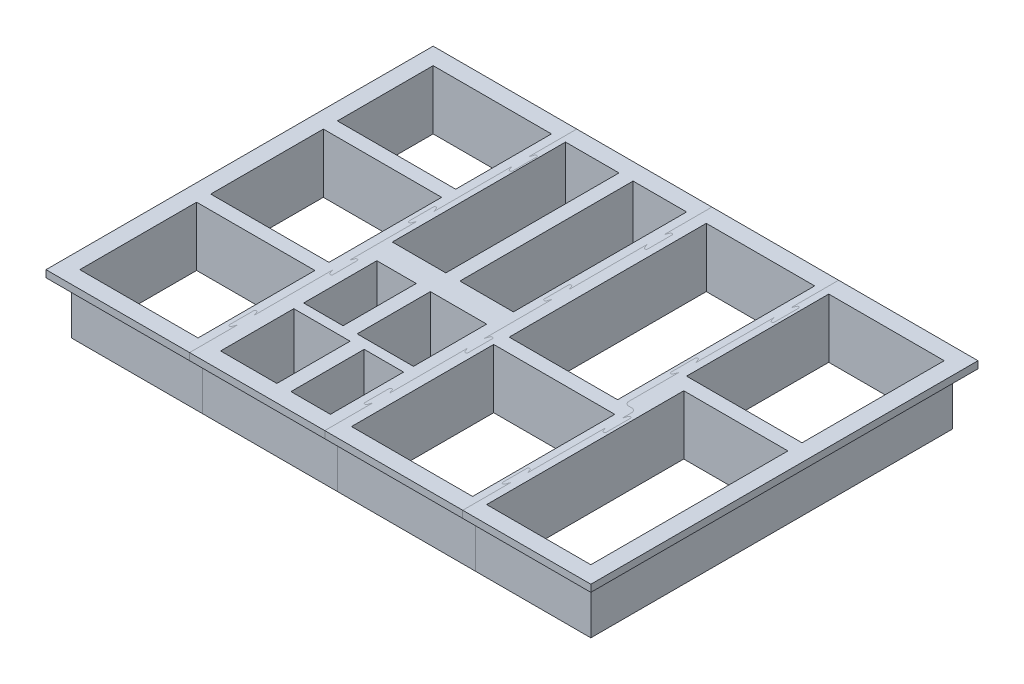
from build123d import *

# Parameters (mm, degrees)
SKETCH1_W                = 387
SKETCH1_H                = 275
BOSS_EXTRUDE1_DEPTH      = 47
SKETCH3_OUTSIDE_W        = 484.416
SKETCH3_OUTSIDE_H        = 372.416
SKETCH3_OUTSIDE_W_2      = 369
SKETCH3_OUTSIDE_H_2      = 257
CUT_EXTRUDE2_DEPTH       = 42
SKETCH2_W                = 84
SKETCH2_H                = 83
SKETCH2_H_2              = 80
SKETCH2_H_3              = 68
SKETCH2_W_2              = 74
SKETCH2_H_4              = 140
SKETCH2_W_3              = 82
SKETCH2_H_5              = 101
SKETCH2_W_4              = 77
SKETCH2_W_5              = 38
SKETCH2_H_6              = 123
SKETCH2_W_6              = 28
SKETCH2_H_7              = 52
SKETCH2_W_7              = 40
SKETCH2_W_8              = 86
CUT_EXTRUDE3_DEPTH       = 43
SKETCH4_W                = 92
SKETCH4_H                = 13.5
CUT_EXTRUDE4_DEPTH       = 35
SPLIT1_SURFACE_1_1_BACK  = 478.078
SPLIT1_SURFACE_1_1_DEPTH = 956.156
SPLIT1_SURFACE_1_2_BACK  = 478.078
SPLIT1_SURFACE_1_2_DEPTH = 956.156
SPLIT1_SURFACE_2_3_BACK  = 478.078
SPLIT1_SURFACE_2_3_DEPTH = 956.156
SPLIT1_SURFACE_2_4_BACK  = 478.078
SPLIT1_SURFACE_2_4_DEPTH = 956.156
SPLIT1_SURFACE_3_5_BACK  = 478.078
SPLIT1_SURFACE_3_5_DEPTH = 956.156
SPLIT1_SURFACE_3_6_BACK  = 478.078
SPLIT1_SURFACE_3_6_DEPTH = 956.156
SKETCH8_W                = 257
SKETCH8_H                = 5
CUT_EXTRUDE5_DEPTH       = 405.968208629


with BuildPart() as part:
    # Sketch1 → Boss-Extrude1 (new body)
    with BuildSketch(Plane(origin=(0, 0, 0), x_dir=(1, 0, 0), z_dir=(0, 1, 0))):
        Rectangle(SKETCH1_W, SKETCH1_H)
    extrude(amount=BOSS_EXTRUDE1_DEPTH)

    # Sketch3 outside → Cut-Extrude2 (cut)
    with BuildSketch(Plane(origin=(0, 0, 0), x_dir=(-1, 0, 0), z_dir=(0, -1, 0))):
        Rectangle(SKETCH3_OUTSIDE_W, SKETCH3_OUTSIDE_H)
        Rectangle(SKETCH3_OUTSIDE_W_2, SKETCH3_OUTSIDE_H_2, mode=Mode.SUBTRACT)
    extrude(amount=-CUT_EXTRUDE2_DEPTH, mode=Mode.SUBTRACT)

    # Sketch2 → Cut-Extrude3 (cut)
    with BuildSketch(Plane(origin=(0, 47, 0), x_dir=(1, 0, 0), z_dir=(0, 1, 0))):
        with Locations((-139.5, -84)):
            Rectangle(SKETCH2_W, SKETCH2_H)
        with Locations((-139.5, 7.5)):
            Rectangle(SKETCH2_W, SKETCH2_H_2)
        with Locations((-139.5, 91.5)):
            Rectangle(SKETCH2_W, SKETCH2_H_3)
        with Locations((144.5, -55.5)):
            Rectangle(SKETCH2_W_2, SKETCH2_H_4)
        with Locations((140.5, 75)):
            Rectangle(SKETCH2_W_3, SKETCH2_H_5)
        with Locations((51, 55.5)):
            Rectangle(SKETCH2_W_4, SKETCH2_H_4)
        with Locations((-20.5, 64)):
            Rectangle(SKETCH2_W_5, SKETCH2_H_6)
        with Locations((-68.5, 64)):
            Rectangle(SKETCH2_W_5, SKETCH2_H_6)
        with Locations((-67.5, -40.5)):
            Rectangle(SKETCH2_W_6, SKETCH2_H_7)
        with Locations((-61.5, -99.5)):
            Rectangle(SKETCH2_W_7, SKETCH2_H_7)
        with Locations((-23.5, -40.5)):
            Rectangle(SKETCH2_W_7, SKETCH2_H_7)
        with Locations((-17.5, -99.5)):
            Rectangle(SKETCH2_W_6, SKETCH2_H_7)
        with Locations((54.5, -75)):
            Rectangle(SKETCH2_W_8, SKETCH2_H_5)
    extrude(amount=-CUT_EXTRUDE3_DEPTH, mode=Mode.SUBTRACT)

    # Sketch4 → Cut-Extrude4 (cut)
    with BuildSketch(Plane.XZ):
        with Locations((-42.5, 6.75)):
            Rectangle(SKETCH4_W, SKETCH4_H)
    extrude(amount=-CUT_EXTRUDE4_DEPTH, mode=Mode.SUBTRACT)


with BuildPart() as body_2:
    # Split1: the piece behind the surface
    add(part.part)
    # Split1 surface 1: a surface, the sketch's curves swept straight by 956.156 mm
    with BuildLine(Plane(origin=(0, 47, 0), x_dir=(1, 0, 0), z_dir=(0, 1, 0)).offset(-SPLIT1_SURFACE_1_1_BACK), mode=Mode.PRIVATE) as split1_surface_1_1_path:
        Line((-91.5, -137.5), (-91.5, -103.5))
        Line((-91.5, -103.5), (-92.560307379, -106.413170582))
        ThreePointArc((-92.560307379, -106.413170582), (-93.673648178, -107.055958192), (-94.5, -106.071150439))
        Line((-94.5, -106.071150439), (-94.5, -88.928849561))
        ThreePointArc((-94.5, -88.928849561), (-93.673648178, -87.944041808), (-92.560307379, -88.586829418))
        Line((-92.560307379, -88.586829418), (-91.5, -91.5))
        Line((-91.5, -91.5), (-91.5, -36))
        Line((-91.5, -36), (-90.439692621, -38.913170582))
        ThreePointArc((-90.439692621, -38.913170582), (-89.326351822, -39.555958192), (-88.5, -38.571150439))
        Line((-88.5, -38.571150439), (-88.5, -21.428849561))
        ThreePointArc((-88.5, -21.428849561), (-89.326351822, -20.444041808), (-90.439692621, -21.086829418))
        Line((-90.439692621, -21.086829418), (-91.5, -24))
        Line((-91.5, -24), (-91.5, 24))
        Line((-91.5, 24), (-92.560307379, 21.086829418))
        ThreePointArc((-92.560307379, 21.086829418), (-93.673648178, 20.444041808), (-94.5, 21.428849561))
        Line((-94.5, 21.428849561), (-94.5, 38.571150439))
        ThreePointArc((-94.5, 38.571150439), (-93.673648178, 39.555958192), (-92.560307379, 38.913170582))
        Line((-92.560307379, 38.913170582), (-91.5, 36))
        Line((-91.5, 36), (-91.5, 91.5))
        Line((-91.5, 91.5), (-90.439692621, 88.586829418))
        ThreePointArc((-90.439692621, 88.586829418), (-89.326351822, 87.944041808), (-88.5, 88.928849561))
        Line((-88.5, 88.928849561), (-88.5, 106.071150439))
        ThreePointArc((-88.5, 106.071150439), (-89.326351822, 107.055958192), (-90.439692621, 106.413170582))
        Line((-90.439692621, 106.413170582), (-91.5, 103.5))
        Line((-91.5, 103.5), (-91.5, 137.5))
    split1_surface_1_1 = Shell.extrude(split1_surface_1_1_path.wire(), (0 * SPLIT1_SURFACE_1_1_DEPTH, 1 * SPLIT1_SURFACE_1_1_DEPTH, 0 * SPLIT1_SURFACE_1_1_DEPTH))
    split(bisect_by=split1_surface_1_1, keep=Keep.BOTTOM)


with BuildPart() as part_1:
    add(part.part)

    # Split1: split by a surface, the side it looks to stays
    # Split1 surface 1: a surface, the sketch's curves swept straight by 956.156 mm
    with BuildLine(Plane(origin=(0, 47, 0), x_dir=(1, 0, 0), z_dir=(0, 1, 0)).offset(-SPLIT1_SURFACE_1_2_BACK), mode=Mode.PRIVATE) as split1_surface_1_2_path:
        Line((-91.5, -137.5), (-91.5, -103.5))
        Line((-91.5, -103.5), (-92.560307379, -106.413170582))
        ThreePointArc((-92.560307379, -106.413170582), (-93.673648178, -107.055958192), (-94.5, -106.071150439))
        Line((-94.5, -106.071150439), (-94.5, -88.928849561))
        ThreePointArc((-94.5, -88.928849561), (-93.673648178, -87.944041808), (-92.560307379, -88.586829418))
        Line((-92.560307379, -88.586829418), (-91.5, -91.5))
        Line((-91.5, -91.5), (-91.5, -36))
        Line((-91.5, -36), (-90.439692621, -38.913170582))
        ThreePointArc((-90.439692621, -38.913170582), (-89.326351822, -39.555958192), (-88.5, -38.571150439))
        Line((-88.5, -38.571150439), (-88.5, -21.428849561))
        ThreePointArc((-88.5, -21.428849561), (-89.326351822, -20.444041808), (-90.439692621, -21.086829418))
        Line((-90.439692621, -21.086829418), (-91.5, -24))
        Line((-91.5, -24), (-91.5, 24))
        Line((-91.5, 24), (-92.560307379, 21.086829418))
        ThreePointArc((-92.560307379, 21.086829418), (-93.673648178, 20.444041808), (-94.5, 21.428849561))
        Line((-94.5, 21.428849561), (-94.5, 38.571150439))
        ThreePointArc((-94.5, 38.571150439), (-93.673648178, 39.555958192), (-92.560307379, 38.913170582))
        Line((-92.560307379, 38.913170582), (-91.5, 36))
        Line((-91.5, 36), (-91.5, 91.5))
        Line((-91.5, 91.5), (-90.439692621, 88.586829418))
        ThreePointArc((-90.439692621, 88.586829418), (-89.326351822, 87.944041808), (-88.5, 88.928849561))
        Line((-88.5, 88.928849561), (-88.5, 106.071150439))
        ThreePointArc((-88.5, 106.071150439), (-89.326351822, 107.055958192), (-90.439692621, 106.413170582))
        Line((-90.439692621, 106.413170582), (-91.5, 103.5))
        Line((-91.5, 103.5), (-91.5, 137.5))
    split1_surface_1_2 = Shell.extrude(split1_surface_1_2_path.wire(), (0 * SPLIT1_SURFACE_1_2_DEPTH, 1 * SPLIT1_SURFACE_1_2_DEPTH, 0 * SPLIT1_SURFACE_1_2_DEPTH))
    split(bisect_by=split1_surface_1_2, keep=Keep.TOP)


with BuildPart() as body_3:
    # Split1 2 body 2: the piece behind the surface
    add(body_2.part)
    # Split1 surface 2: a surface, the sketch's curves swept straight by 956.156 mm
    with BuildLine(Plane(origin=(0, 47, 0), x_dir=(1, 0, 0), z_dir=(0, 1, 0)).offset(-SPLIT1_SURFACE_2_3_BACK), mode=Mode.PRIVATE) as split1_surface_2_3_path:
        Line((4.5, 137.5), (4.5, 103.5))
        Line((4.5, 103.5), (5.560307379, 106.413170582))
        ThreePointArc((5.560307379, 106.413170582), (6.673648178, 107.055958192), (7.5, 106.071150439))
        Line((7.5, 106.071150439), (7.5, 88.928849561))
        ThreePointArc((7.5, 88.928849561), (6.673648178, 87.944041808), (5.560307379, 88.586829418))
        Line((5.560307379, 88.586829418), (4.5, 91.5))
        Line((4.5, 91.5), (4.5, 36))
        Line((4.5, 36), (3.439692621, 38.913170582))
        ThreePointArc((3.439692621, 38.913170582), (2.326351822, 39.555958192), (1.5, 38.571150439))
        Line((1.5, 38.571150439), (1.5, 21.428849561))
        ThreePointArc((1.5, 21.428849561), (2.326351822, 20.444041808), (3.439692621, 21.086829418))
        Line((3.439692621, 21.086829418), (4.5, 24))
        Line((4.5, 24), (4.5, -24))
        Line((4.5, -24), (5.560307379, -21.086829418))
        ThreePointArc((5.560307379, -21.086829418), (6.673648178, -20.444041808), (7.5, -21.428849561))
        Line((7.5, -21.428849561), (7.5, -38.571150439))
        ThreePointArc((7.5, -38.571150439), (6.673648178, -39.555958192), (5.560307379, -38.913170582))
        Line((5.560307379, -38.913170582), (4.5, -36))
        Line((4.5, -36), (4.5, -91.5))
        Line((4.5, -91.5), (3.439692621, -88.586829418))
        ThreePointArc((3.439692621, -88.586829418), (2.326351822, -87.944041808), (1.5, -88.928849561))
        Line((1.5, -88.928849561), (1.5, -106.071150439))
        ThreePointArc((1.5, -106.071150439), (2.326351822, -107.055958192), (3.439692621, -106.413170582))
        Line((3.439692621, -106.413170582), (4.5, -103.5))
        Line((4.5, -103.5), (4.5, -137.5))
    split1_surface_2_3 = Shell.extrude(split1_surface_2_3_path.wire(), (0 * SPLIT1_SURFACE_2_3_DEPTH, 1 * SPLIT1_SURFACE_2_3_DEPTH, 0 * SPLIT1_SURFACE_2_3_DEPTH))
    split(bisect_by=split1_surface_2_3, keep=Keep.BOTTOM)


with BuildPart() as body_2_1:
    add(body_2.part)

    # Split1 2 body 2: split by a surface, the side it looks to stays
    # Split1 surface 2: a surface, the sketch's curves swept straight by 956.156 mm
    with BuildLine(Plane(origin=(0, 47, 0), x_dir=(1, 0, 0), z_dir=(0, 1, 0)).offset(-SPLIT1_SURFACE_2_4_BACK), mode=Mode.PRIVATE) as split1_surface_2_4_path:
        Line((4.5, 137.5), (4.5, 103.5))
        Line((4.5, 103.5), (5.560307379, 106.413170582))
        ThreePointArc((5.560307379, 106.413170582), (6.673648178, 107.055958192), (7.5, 106.071150439))
        Line((7.5, 106.071150439), (7.5, 88.928849561))
        ThreePointArc((7.5, 88.928849561), (6.673648178, 87.944041808), (5.560307379, 88.586829418))
        Line((5.560307379, 88.586829418), (4.5, 91.5))
        Line((4.5, 91.5), (4.5, 36))
        Line((4.5, 36), (3.439692621, 38.913170582))
        ThreePointArc((3.439692621, 38.913170582), (2.326351822, 39.555958192), (1.5, 38.571150439))
        Line((1.5, 38.571150439), (1.5, 21.428849561))
        ThreePointArc((1.5, 21.428849561), (2.326351822, 20.444041808), (3.439692621, 21.086829418))
        Line((3.439692621, 21.086829418), (4.5, 24))
        Line((4.5, 24), (4.5, -24))
        Line((4.5, -24), (5.560307379, -21.086829418))
        ThreePointArc((5.560307379, -21.086829418), (6.673648178, -20.444041808), (7.5, -21.428849561))
        Line((7.5, -21.428849561), (7.5, -38.571150439))
        ThreePointArc((7.5, -38.571150439), (6.673648178, -39.555958192), (5.560307379, -38.913170582))
        Line((5.560307379, -38.913170582), (4.5, -36))
        Line((4.5, -36), (4.5, -91.5))
        Line((4.5, -91.5), (3.439692621, -88.586829418))
        ThreePointArc((3.439692621, -88.586829418), (2.326351822, -87.944041808), (1.5, -88.928849561))
        Line((1.5, -88.928849561), (1.5, -106.071150439))
        ThreePointArc((1.5, -106.071150439), (2.326351822, -107.055958192), (3.439692621, -106.413170582))
        Line((3.439692621, -106.413170582), (4.5, -103.5))
        Line((4.5, -103.5), (4.5, -137.5))
    split1_surface_2_4 = Shell.extrude(split1_surface_2_4_path.wire(), (0 * SPLIT1_SURFACE_2_4_DEPTH, 1 * SPLIT1_SURFACE_2_4_DEPTH, 0 * SPLIT1_SURFACE_2_4_DEPTH))
    split(bisect_by=split1_surface_2_4, keep=Keep.TOP)


with BuildPart() as body_4:
    # Split1 3 body 2: the piece behind the surface
    add(body_2_1.part)
    # Split1 surface 3: a surface, the sketch's curves swept straight by 956.156 mm
    with BuildLine(Plane(origin=(0, 47, 0), x_dir=(1, 0, 0), z_dir=(0, 1, 0)).offset(-SPLIT1_SURFACE_3_5_BACK), mode=Mode.PRIVATE) as split1_surface_3_5_path:
        Line((102.5, -137.5), (102.5, -103.5))
        Line((102.5, -103.5), (101.439692621, -106.413170582))
        ThreePointArc((101.439692621, -106.413170582), (100.326351822, -107.055958192), (99.5, -106.071150439))
        Line((99.5, -106.071150439), (99.5, -88.928849561))
        ThreePointArc((99.5, -88.928849561), (100.326351822, -87.944041808), (101.439692621, -88.586829418))
        Line((101.439692621, -88.586829418), (102.5, -91.5))
        Line((102.5, -91.5), (102.5, -36))
        Line((102.5, -36), (103.560307379, -38.913170582))
        ThreePointArc((103.560307379, -38.913170582), (104.673648178, -39.555958192), (105.5, -38.571150439))
        Line((105.5, -38.571150439), (105.5, -21.428849561))
        ThreePointArc((105.5, -21.428849561), (104.673648178, -20.444041808), (103.560307379, -21.086829418))
        Line((103.560307379, -21.086829418), (102.5, -24))
        Line((102.5, -24), (102.5, -17.5))
        ThreePointArc((102.5, -17.5), (101.621320344, -15.378679656), (99.5, -14.5))
        Line((99.5, -14.5), (97.5, -14.5))
        ThreePointArc((97.5, -14.5), (95.378679656, -13.621320344), (94.5, -11.5))
        Line((94.5, -11.5), (94.5, 24))
        Line((94.5, 24), (93.439692621, 21.086829418))
        ThreePointArc((93.439692621, 21.086829418), (92.326351822, 20.444041808), (91.5, 21.428849561))
        Line((91.5, 21.428849561), (91.5, 38.571150439))
        ThreePointArc((91.5, 38.571150439), (92.326351822, 39.555958192), (93.439692621, 38.913170582))
        Line((93.439692621, 38.913170582), (94.5, 36))
        Line((94.5, 36), (94.5, 91.5))
        Line((94.5, 91.5), (95.560307379, 88.586829418))
        ThreePointArc((95.560307379, 88.586829418), (96.673648178, 87.944041808), (97.5, 88.928849561))
        Line((97.5, 88.928849561), (97.5, 106.071150439))
        ThreePointArc((97.5, 106.071150439), (96.673648178, 107.055958192), (95.560307379, 106.413170582))
        Line((95.560307379, 106.413170582), (94.5, 103.5))
        Line((94.5, 103.5), (94.5, 137.5))
    split1_surface_3_5 = Shell.extrude(split1_surface_3_5_path.wire(), (0 * SPLIT1_SURFACE_3_5_DEPTH, 1 * SPLIT1_SURFACE_3_5_DEPTH, 0 * SPLIT1_SURFACE_3_5_DEPTH))
    split(bisect_by=split1_surface_3_5, keep=Keep.BOTTOM)


with BuildPart() as body_2_2:
    add(body_2_1.part)

    # Split1 3 body 2: split by a surface, the side it looks to stays
    # Split1 surface 3: a surface, the sketch's curves swept straight by 956.156 mm
    with BuildLine(Plane(origin=(0, 47, 0), x_dir=(1, 0, 0), z_dir=(0, 1, 0)).offset(-SPLIT1_SURFACE_3_6_BACK), mode=Mode.PRIVATE) as split1_surface_3_6_path:
        Line((102.5, -137.5), (102.5, -103.5))
        Line((102.5, -103.5), (101.439692621, -106.413170582))
        ThreePointArc((101.439692621, -106.413170582), (100.326351822, -107.055958192), (99.5, -106.071150439))
        Line((99.5, -106.071150439), (99.5, -88.928849561))
        ThreePointArc((99.5, -88.928849561), (100.326351822, -87.944041808), (101.439692621, -88.586829418))
        Line((101.439692621, -88.586829418), (102.5, -91.5))
        Line((102.5, -91.5), (102.5, -36))
        Line((102.5, -36), (103.560307379, -38.913170582))
        ThreePointArc((103.560307379, -38.913170582), (104.673648178, -39.555958192), (105.5, -38.571150439))
        Line((105.5, -38.571150439), (105.5, -21.428849561))
        ThreePointArc((105.5, -21.428849561), (104.673648178, -20.444041808), (103.560307379, -21.086829418))
        Line((103.560307379, -21.086829418), (102.5, -24))
        Line((102.5, -24), (102.5, -17.5))
        ThreePointArc((102.5, -17.5), (101.621320344, -15.378679656), (99.5, -14.5))
        Line((99.5, -14.5), (97.5, -14.5))
        ThreePointArc((97.5, -14.5), (95.378679656, -13.621320344), (94.5, -11.5))
        Line((94.5, -11.5), (94.5, 24))
        Line((94.5, 24), (93.439692621, 21.086829418))
        ThreePointArc((93.439692621, 21.086829418), (92.326351822, 20.444041808), (91.5, 21.428849561))
        Line((91.5, 21.428849561), (91.5, 38.571150439))
        ThreePointArc((91.5, 38.571150439), (92.326351822, 39.555958192), (93.439692621, 38.913170582))
        Line((93.439692621, 38.913170582), (94.5, 36))
        Line((94.5, 36), (94.5, 91.5))
        Line((94.5, 91.5), (95.560307379, 88.586829418))
        ThreePointArc((95.560307379, 88.586829418), (96.673648178, 87.944041808), (97.5, 88.928849561))
        Line((97.5, 88.928849561), (97.5, 106.071150439))
        ThreePointArc((97.5, 106.071150439), (96.673648178, 107.055958192), (95.560307379, 106.413170582))
        Line((95.560307379, 106.413170582), (94.5, 103.5))
        Line((94.5, 103.5), (94.5, 137.5))
    split1_surface_3_6 = Shell.extrude(split1_surface_3_6_path.wire(), (0 * SPLIT1_SURFACE_3_6_DEPTH, 1 * SPLIT1_SURFACE_3_6_DEPTH, 0 * SPLIT1_SURFACE_3_6_DEPTH))
    split(bisect_by=split1_surface_3_6, keep=Keep.TOP)


with BuildPart() as cut_extrude5_tool:
    # Sketch8 → Cut-Extrude5 (new, through all)
    with BuildSketch(Plane.ZY.offset(184.5)):
        with Locations((0, 2.5)):
            Rectangle(SKETCH8_W, SKETCH8_H)
    extrude(amount=-CUT_EXTRUDE5_DEPTH)


with BuildPart() as part_2:
    add(part_1.part)

    # Cut-Extrude5: cut by cut_extrude5_tool
    add(cut_extrude5_tool.part, mode=Mode.SUBTRACT)


with BuildPart() as body_2_3:
    add(body_2_2.part)

    # Cut-Extrude5: cut by cut_extrude5_tool
    add(cut_extrude5_tool.part, mode=Mode.SUBTRACT)


with BuildPart() as body_3_1:
    add(body_3.part)

    # Cut-Extrude5: cut by cut_extrude5_tool
    add(cut_extrude5_tool.part, mode=Mode.SUBTRACT)


with BuildPart() as body_4_1:
    add(body_4.part)

    # Cut-Extrude5: cut by cut_extrude5_tool
    add(cut_extrude5_tool.part, mode=Mode.SUBTRACT)


solid = Compound([part_2.part, body_2_3.part, body_3_1.part, body_4_1.part])
